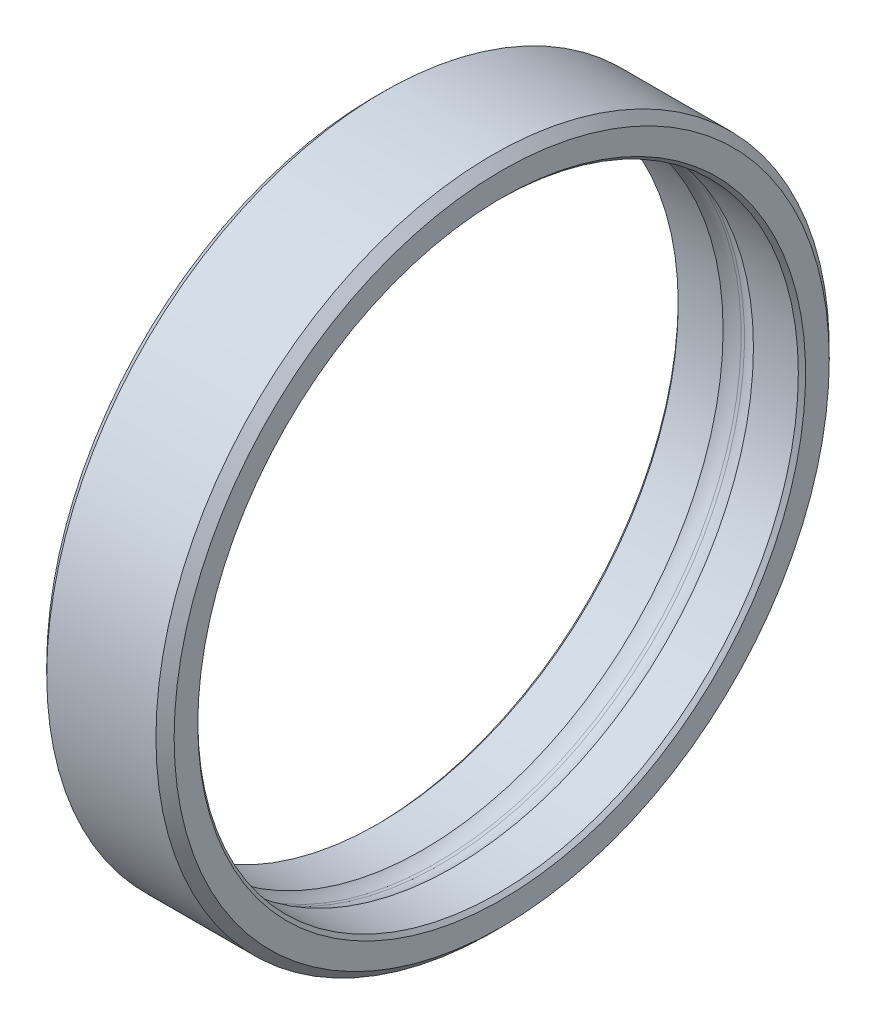
from build123d import *

# Parameters (mm, degrees)
CHAMFER_1_SIZE = 0.5
CHAMFER_2_SIZE = 0.2


with BuildPart() as part:
    # Эскиз1 → Повернуть1 (revolve)
    with BuildSketch(Plane.XY, mode=Mode.PRIVATE) as revolve_1_sk:
        with BuildLine():
            Line((0.833368845, 16.5), (3.5, 16.5))
            Line((3.5, 16.5), (3.5, 18.5))
            Line((3.5, 18.5), (-3.5, 18.5))
            Line((-3.5, 18.5), (-3.5, 16.5))
            Line((-3.5, 16.5), (-0.833368845, 16.5))
            ThreePointArc((-0.833368845, 16.5), (-0.47911964, 16.67422796), (-0.091683865, 16.75))
            Line((-0.091683865, 16.75), (0.091683865, 16.75))
            ThreePointArc((0.091683865, 16.75), (0.47911964, 16.67422796), (0.833368845, 16.5))
        make_face()
    revolve(revolve_1_sk.sketch.rotate(Axis((0, 0, 0), (1, 0, 0)), 90), axis=Axis((0, 0, 0), (1, 0, 0)))

    # Фаска1
    chamfer_1_edges = [part.edges().sort_by_distance(p)[0] for p in [
        (-3.5, 0, -18.5),
        (3.5, 0, -18.5),
    ]]
    chamfer(chamfer_1_edges, length=CHAMFER_1_SIZE)

    # Фаска2
    chamfer_2_edges = [part.edges().sort_by_distance(p)[0] for p in [
        (3.5, 0, -16.5),
        (-3.5, 0, -16.5),
    ]]
    chamfer(chamfer_2_edges, length=CHAMFER_2_SIZE)


solid = part.part
